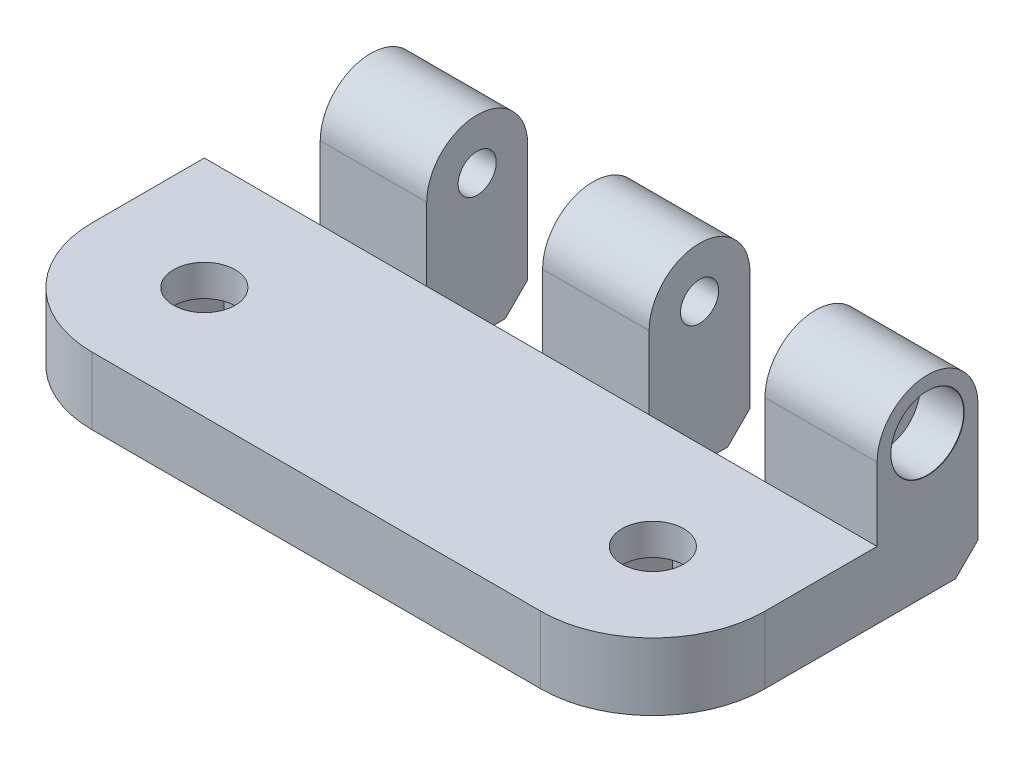
from build123d import *

# Parameters (mm, degrees)
BOSS_EXTRUDE1_DEPTH = 30
CHAMFER1_SIZE       = 2
FILLET1_R           = 10
SKETCH2_W           = 10.333333333
SKETCH2_H           = 9
SKETCH2_W_2         = 10.333333334
CUT_EXTRUDE1_DEPTH  = 43.299527184
CUT_EXTRUDE2_DEPTH  = 3.2
SKETCH7_R           = 2.75
CUT_EXTRUDE3_DEPTH  = 2.8


with BuildPart() as part:
    # Sketch1 → Boss-Extrude1 (new, symmetric)
    with BuildSketch(Plane(origin=(0, 0, 0), x_dir=(0, 0, -1), z_dir=(1, 0, 0))):
        with BuildLine():
            Line((4.5, 0), (4.5, -12.5))
            Line((4.5, -12.5), (-24.5, -12.5))
            Line((-24.5, -12.5), (-24.5, -6.5))
            Line((-24.5, -6.5), (-4.5, -6.5))
            Line((-4.5, -6.5), (-4.5, 0))
            ThreePointArc((-4.5, 0), (0, 4.5), (4.5, 0))
        make_face()
    extrude(amount=BOSS_EXTRUDE1_DEPTH, both=True)

    # Chamfer1
    chamfer1_edges = [part.edges().sort_by_distance(p)[0] for p in [
        (0, -12.5, -4.5),
    ]]
    chamfer(chamfer1_edges, length=CHAMFER1_SIZE)

    # Fillet1
    fillet1_edges = [part.edges().sort_by_distance(p)[0] for p in [
        (-30, -9.5, 24.5),
        (30, -9.5, 24.5),
    ]]
    fillet(fillet1_edges, radius=FILLET1_R)

    # Sketch2 → Cut-Extrude1 (cut, through all)
    with BuildSketch(Plane.XZ.offset(12.5)):
        with Locations((-24.833333334, 0)):
            Rectangle(SKETCH2_W, SKETCH2_H)
        with Locations((-5, 0)):
            Rectangle(SKETCH2_W_2, SKETCH2_H)
        with Locations((14.833333334, 0)):
            Rectangle(SKETCH2_W, SKETCH2_H)
    extrude(amount=-CUT_EXTRUDE1_DEPTH, mode=Mode.SUBTRACT)

    # Sketch5 → CBORE for M3 Hex Socket Head Cap Screw1 (revolve, cut)
    with BuildSketch(Plane(origin=(30, 0, 0), x_dir=(0, 0, -1), z_dir=(0, 1, 0))):
        Polygon((0, 0), (0, 60), (1.7, 60), (1.7, 3.9), (3.25, 3.9), (3.25, 0.025), (3.275, 0), align=None)
    revolve(axis=Axis((36.35, 0, 0), (-1, 0, 0)), mode=Mode.SUBTRACT)

    # Sketch6 → Cut-Extrude2 (cut)
    with BuildSketch(Plane.XZ.offset(12.5)):
        Polygon((24.792007234, 14.5), (22.396003617, 18.65), (17.603996383, 18.65), (15.207992766, 14.5), (17.603996383, 10.35), (22.396003617, 10.35), align=None)
        Polygon((-15.207992766, 14.5), (-17.603996383, 18.65), (-22.396003617, 18.65), (-24.792007234, 14.5), (-22.396003617, 10.35), (-17.603996383, 10.35), align=None)
    extrude(amount=-CUT_EXTRUDE2_DEPTH, mode=Mode.SUBTRACT)

    # Sketch7 → Cut-Extrude3 (cut)
    with BuildSketch(Plane.XZ.offset(9.3)):
        with Locations(Location((-20, 14.5, 0), (0, 0, 270))):
            Circle(SKETCH7_R)
        with Locations(Location((20, 14.5, 0), (0, 0, 270))):
            Circle(SKETCH7_R)
    extrude(amount=-CUT_EXTRUDE3_DEPTH, mode=Mode.SUBTRACT)


solid = part.part
